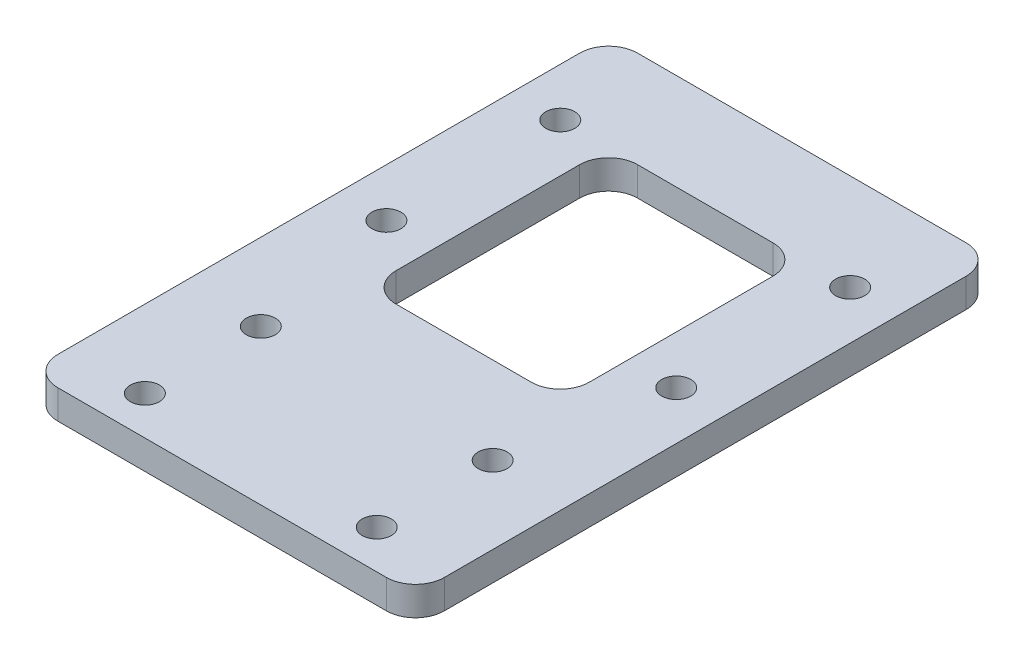
from build123d import *

# Parameters (mm, degrees)
SKETCH_1_W          = 40
SKETCH_1_H          = 60
SKETCH_1_R          = 1.5
EXTRUDE_1_DEPTH     = 3
FILLET_1_R          = 3
SKETCH_5_W          = 20
SKETCH_5_H          = 25
CUT_EXTRUDE_1_DEPTH = 38.89032563
FILLET_2_R          = 3


with BuildPart() as part:
    # 草图1 → 凸台-拉伸1 (new body)
    with BuildSketch(Plane(origin=(0, 0, 0), x_dir=(1, 0, 0), z_dir=(0, 1, 0))):
        with Locations((2.097965146, 0.632608651)):
            Rectangle(SKETCH_1_W, SKETCH_1_H)
        with Locations(Location((14.097965146, -25.367391349, 0), (0, 0, 270))):
            Circle(SKETCH_1_R, mode=Mode.SUBTRACT)
        with Locations(Location((-9.902034854, -25.367391349, 0), (0, 0, 270))):
            Circle(SKETCH_1_R, mode=Mode.SUBTRACT)
        with Locations(Location((14.097965146, -13.367391349, 0), (0, 0, 270))):
            Circle(SKETCH_1_R, mode=Mode.SUBTRACT)
        with Locations(Location((-9.902034854, -13.367391349, 0), (0, 0, 270))):
            Circle(SKETCH_1_R, mode=Mode.SUBTRACT)
        with Locations(Location((17.097965146, 2.632608651, 0), (0, 0, 270))):
            Circle(SKETCH_1_R, mode=Mode.SUBTRACT)
        with Locations(Location((-12.902034854, 2.632608651, 0), (0, 0, 270))):
            Circle(SKETCH_1_R, mode=Mode.SUBTRACT)
        with Locations(Location((17.097965146, 20.632608651, 0), (0, 0, 270))):
            Circle(SKETCH_1_R, mode=Mode.SUBTRACT)
        with Locations(Location((-12.902034854, 20.632608651, 0), (0, 0, 270))):
            Circle(SKETCH_1_R, mode=Mode.SUBTRACT)
    extrude(amount=EXTRUDE_1_DEPTH)

    # 圆角1
    fillet_1_edges = [part.edges().sort_by_distance(p)[0] for p in [
        (-17.902034854, 1.5, -30.632608651),
        (22.097965146, 1.5, -30.632608651),
        (22.097965146, 1.5, 29.367391349),
        (-17.902034854, 1.5, 29.367391349),
    ]]
    fillet(fillet_1_edges, radius=FILLET_1_R)

    # 草图5 → 切除-拉伸1 (cut, through all)
    with BuildSketch(Plane(origin=(0, 3, 0), x_dir=(1, 0, 0), z_dir=(0, 1, 0))):
        with Locations((2.097965146, 8.132608651)):
            Rectangle(SKETCH_5_W, SKETCH_5_H)
    extrude(amount=-CUT_EXTRUDE_1_DEPTH, mode=Mode.SUBTRACT)

    # 圆角2
    fillet_2_edges = [part.edges().sort_by_distance(p)[0] for p in [
        (-7.902034854, 1.5, 4.367391349),
        (-7.902034854, 1.5, -20.632608651),
        (12.097965146, 1.5, -20.632608651),
        (12.097965146, 1.5, 4.367391349),
    ]]
    fillet(fillet_2_edges, radius=FILLET_2_R)


solid = part.part
